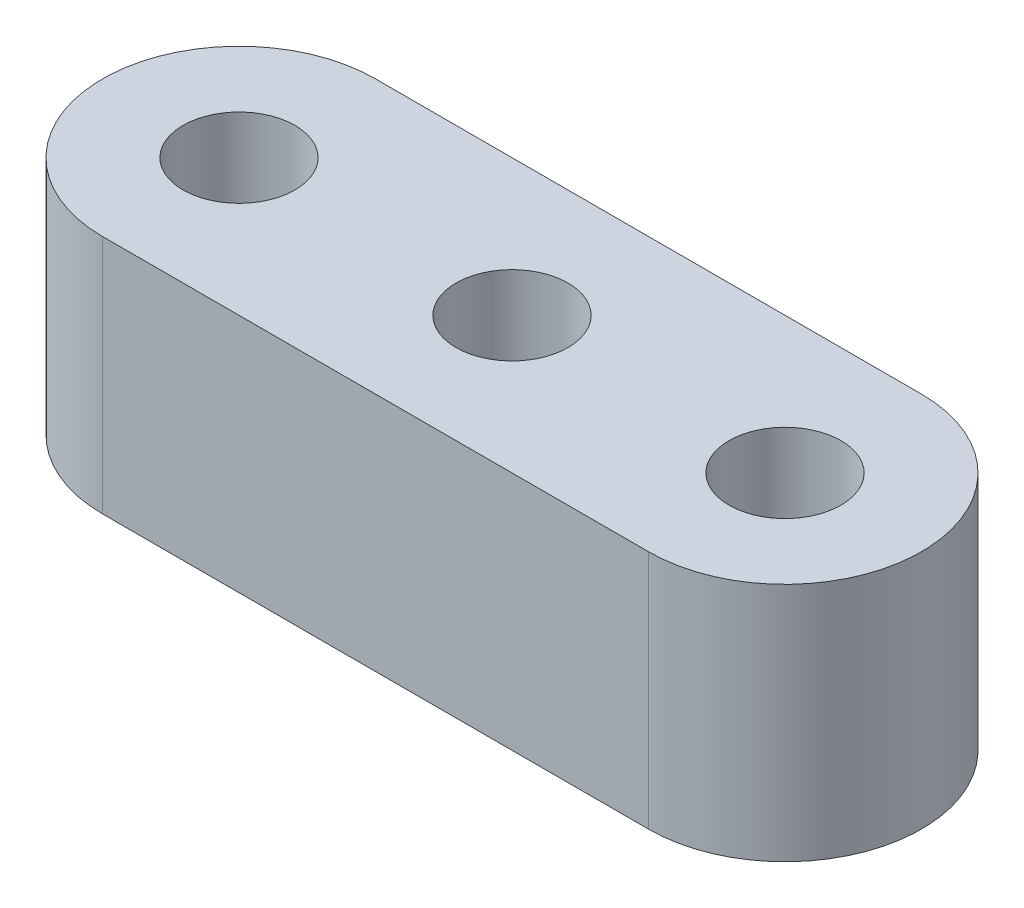
from build123d import *

# Parameters (mm, degrees)
SKETCH1_R           = 2.05
BOSS_EXTRUDE1_DEPTH = 4.4


with BuildPart() as part:
    # Sketch1 → Boss-Extrude1 (new, symmetric)
    with BuildSketch(Plane(origin=(0, 0, 0), x_dir=(1, 0, 0), z_dir=(0, 1, 0))):
        with BuildLine():
            Line((-10, 0), (-5, 0))
            Line((-5, 0), (5, 0))
            Line((5, 0), (10, 0))
            ThreePointArc((10, 0), (15, -5), (10, -10))
            Line((10, -10), (5, -10))
            Line((5, -10), (-5, -10))
            Line((-5, -10), (-10, -10))
            ThreePointArc((-10, -10), (-15, -5), (-10, 0))
        make_face()
        with Locations(Location((10, -5, 0), (0, 0, 270))):
            Circle(SKETCH1_R, mode=Mode.SUBTRACT)
        with Locations(Location((-10, -5, 0), (0, 0, 90))):
            Circle(SKETCH1_R, mode=Mode.SUBTRACT)
        with Locations(Location((0, -5, 0), (0, 0, 270))):
            Circle(SKETCH1_R, mode=Mode.SUBTRACT)
    extrude(amount=BOSS_EXTRUDE1_DEPTH, both=True)


solid = part.part
